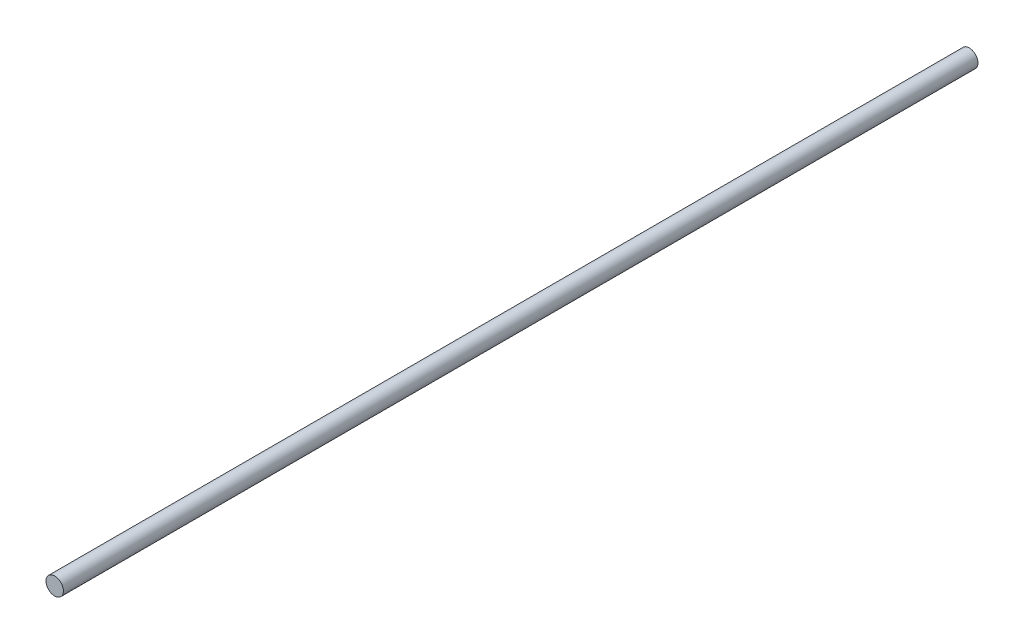
from build123d import *

# Parameters (mm, degrees)
SKETCH_1_R      = 4
EXTRUDE_1_DEPTH = 420


with BuildPart() as part:
    # Эскиз1 → Бобышка-Вытянуть1 (new body)
    with BuildSketch(Plane.XY):
        Circle(SKETCH_1_R)
    extrude(amount=EXTRUDE_1_DEPTH)


solid = part.part
